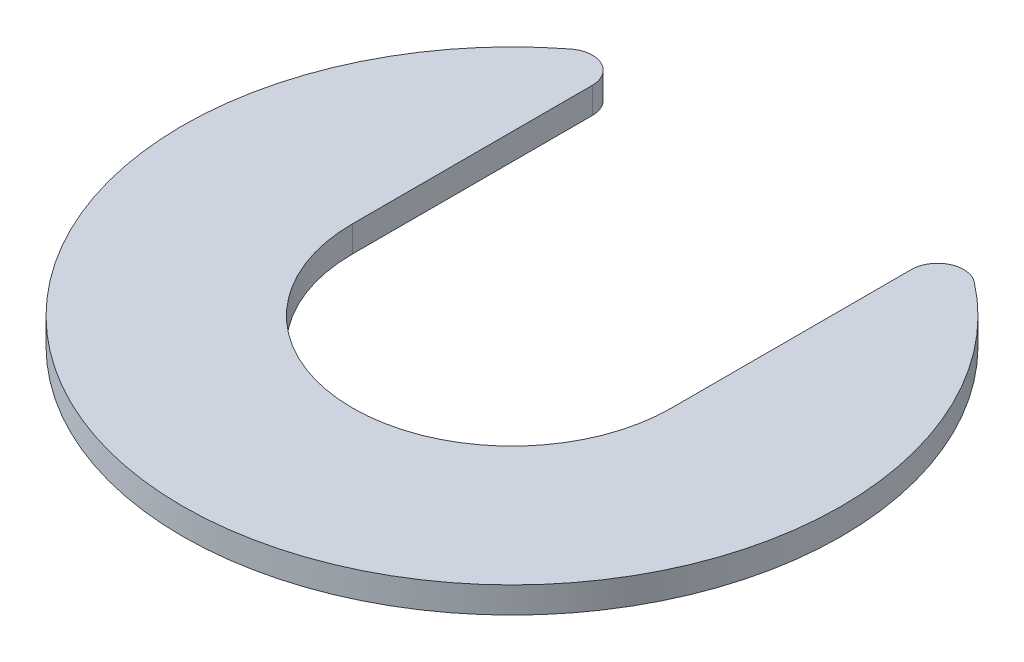
from build123d import *

# Parameters (mm, degrees)
SKETCH1_R               = 12.6
BOSS_EXTRUDE1_DEPTH     = 1
CUT_EXTRUDE4_DEPTH      = 18.847128621
CUT_EXTRUDE4_DEPTH_BACK = 18.847128621
FILLET1_R               = 1


with BuildPart() as part:
    # Sketch1 → Boss-Extrude1 (new body)
    with BuildSketch(Plane(origin=(0, 0, 0), x_dir=(1, 0, 0), z_dir=(0, 1, 0))):
        with Locations(Location((0, 0, 0), (0, 0, 270))):
            Circle(SKETCH1_R)
    extrude(amount=BOSS_EXTRUDE1_DEPTH)

    # Sketch2 → Cut-Extrude4 (cut, two sides: drawn at the far end of the back side and taken through both)
    with BuildSketch(Plane(origin=(0, 0, 0), x_dir=(1, 0, 0), z_dir=(0, 1, 0)).offset(-CUT_EXTRUDE4_DEPTH_BACK)):
        with BuildLine():
            Line((-6.1, 0), (-6.1, 13.442202198))
            ThreePointArc((-6.1, 13.442202198), (0, 19.542202198), (6.1, 13.442202198))
            Line((6.1, 13.442202198), (6.1, 0))
            ThreePointArc((6.1, 0), (0, -6.1), (-6.1, 0))
        make_face()
    extrude(amount=CUT_EXTRUDE4_DEPTH + CUT_EXTRUDE4_DEPTH_BACK, mode=Mode.SUBTRACT)

    # Fillet1
    fillet1_edges = [part.edges().sort_by_distance(p)[0] for p in [
        (6.1, 0.5, -11.024971655),
        (-6.1, 0.5, -11.024971655),
    ]]
    fillet(fillet1_edges, radius=FILLET1_R)


solid = part.part
